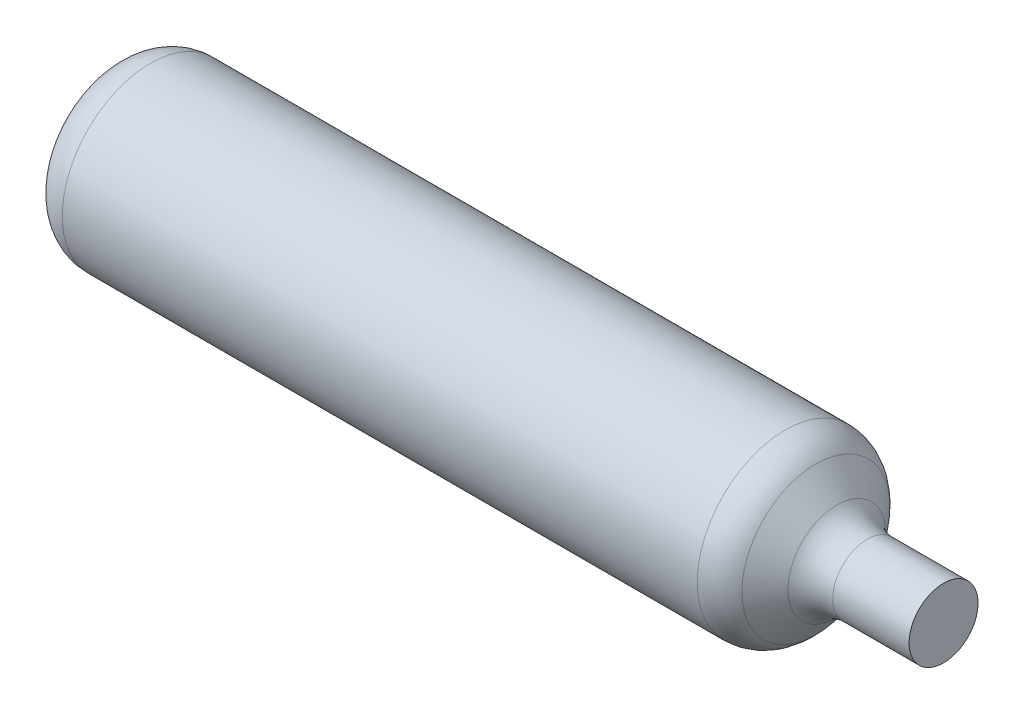
from build123d import *

# Parameters (mm, degrees)
ZAOBLIT1_R = 20


with BuildPart() as part:
    # Skica1 → Rotovat1 (revolve)
    with BuildSketch(Plane.XY, mode=Mode.PRIVATE) as rotovat1_sk:
        Polygon((0, 0), (0, 44.5), (349.599506462, 44.5), (372.134762873, 17.400641026), (420, 17.400641026), (420, 0), align=None)
    revolve(rotovat1_sk.sketch.rotate(Axis((0, 0, 0), (1, 0, 0)), 90), axis=Axis((0, 0, 0), (1, 0, 0)))

    # Zaoblit1
    zaoblit1_edges = [part.edges().sort_by_distance(p)[0] for p in [
        (372.134762873, 0, -17.400641026),
        (349.599506462, 0, -44.5),
        (0, 0, -44.5),
    ]]
    fillet(zaoblit1_edges, radius=ZAOBLIT1_R)


solid = part.part
